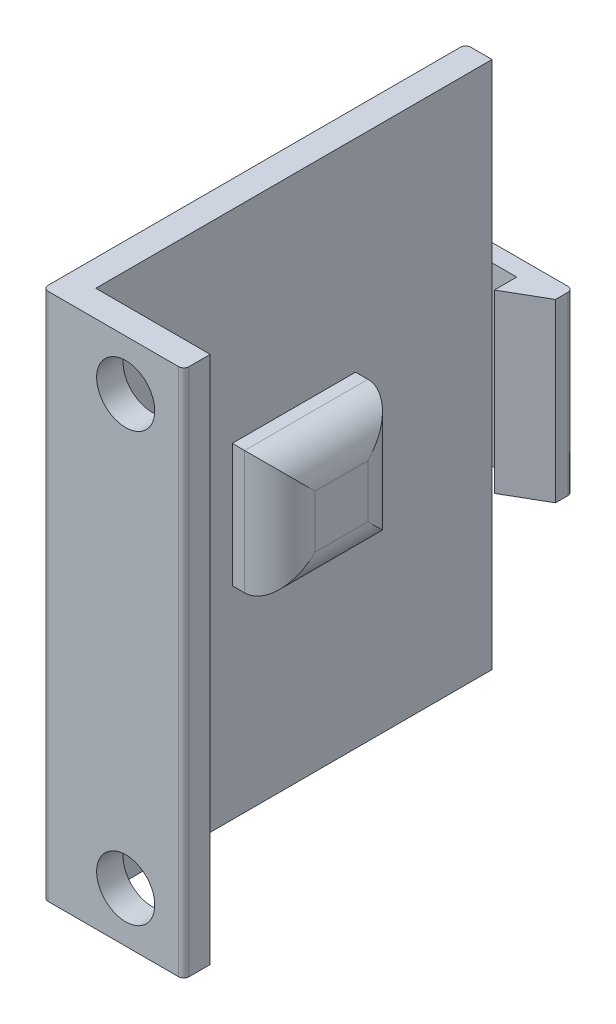
from build123d import *

# Parameters (mm, degrees)
BOSS_EXTRUDE1_DEPTH      = 5
BOSS_EXTRUDE1_DEPTH_BACK = 5
SKETCH2_W                = 3.6
SKETCH2_H                = 10
BOSS_EXTRUDE2_DEPTH      = 1
BOSS_EXTRUDE3_DEPTH      = 1.5
SKETCH4_W                = 8
SKETCH4_H                = 30
SKETCH4_R                = 1.65
BOSS_EXTRUDE4_DEPTH      = 1.5
FILLET1_R                = 0.3
SKETCH5_W                = 7
SKETCH5_H                = 7
BOSS_EXTRUDE5_DEPTH      = 2.7
FILLET2_R                = 2


with BuildPart() as part:
    # Sketch1 → Boss-Extrude1 (new, two sides: drawn at the far end of the back side and taken through both)
    with BuildSketch(Plane(origin=(0, 0, 0), x_dir=(1, 0, 0), z_dir=(0, 1, 0)).offset(-BOSS_EXTRUDE1_DEPTH_BACK)):
        Polygon((0, 0), (-2.2, 0), (-2.2, -1.270170592), align=None)
    extrude(amount=BOSS_EXTRUDE1_DEPTH + BOSS_EXTRUDE1_DEPTH_BACK)

    # Sketch2 → Boss-Extrude2 (add)
    with BuildSketch(Plane(origin=(0, 0, 0), x_dir=(-1, 0, 0), z_dir=(0, 0, -1))):
        with Locations((1.8, 0)):
            Rectangle(SKETCH2_W, SKETCH2_H)
    extrude(amount=BOSS_EXTRUDE2_DEPTH)

    # Sketch3 → Boss-Extrude3 (add)
    with BuildSketch(Plane.ZY.offset(3.6)):
        Polygon((0, -5), (0, -15), (22.5, -15), (22.5, 15), (0, 15), (0, 5), (-1, 5), (-1, -5), align=None)
    extrude(amount=BOSS_EXTRUDE3_DEPTH)

    # Sketch4 → Boss-Extrude4 (add)
    with BuildSketch(Plane.XY.offset(22.5)):
        with Locations((-1.1, 0)):
            Rectangle(SKETCH4_W, SKETCH4_H)
        with Locations((-0.4, 12.15)):
            Circle(SKETCH4_R, mode=Mode.SUBTRACT)
        with Locations((-0.4, -12.15)):
            Circle(SKETCH4_R, mode=Mode.SUBTRACT)
    extrude(amount=BOSS_EXTRUDE4_DEPTH)

    # Fillet1
    fillet1_edges = [part.edges().sort_by_distance(p)[0] for p in [
        (-5.1, 0, -1),
        (-5.1, 0, 24),
        (-5.1, -10, 0),
        (-5.1, 10, 0),
        (2.9, 0, 24),
        (0, 0, -1),
    ]]
    fillet(fillet1_edges, radius=FILLET1_R)

    # Sketch5 → Boss-Extrude5 (add)
    with BuildSketch(Plane(origin=(-3.6, 0, 0), x_dir=(0, 0, -1), z_dir=(1, 0, 0))):
        with Locations((-11.25, 0)):
            Rectangle(SKETCH5_W, SKETCH5_H)
    extrude(amount=BOSS_EXTRUDE5_DEPTH)

    # Fillet2
    fillet2_edges = [part.edges().sort_by_distance(p)[0] for p in [
        (-0.9, 0, 14.75),
        (-0.9, 3.5, 11.25),
        (-0.9, 0, 7.75),
        (-0.9, -3.5, 11.25),
    ]]
    fillet(fillet2_edges, radius=FILLET2_R)


solid = part.part
